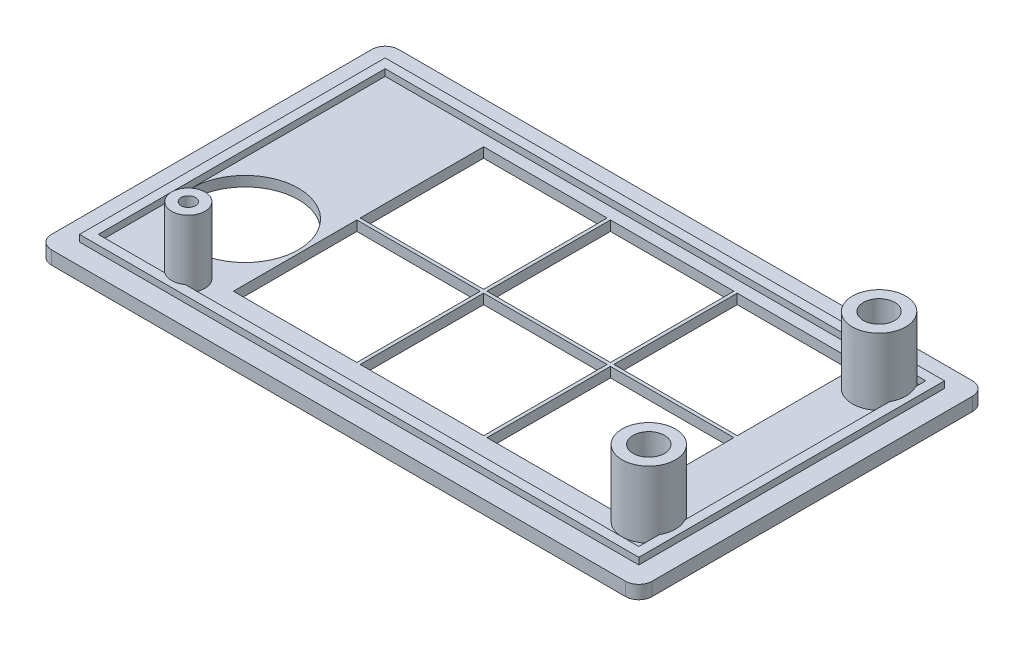
from build123d import *

# Parameters (mm, degrees)
SKETCH3_W               = 90
SKETCH3_H               = 52
BOSS_EXTRUDE2_DEPTH     = 2
FILLET2_R               = 2
BOSS_EXTRUDE3_START     = 2
SKETCH7_R               = 4
BOSS_EXTRUDE3_DEPTH     = 10
CUT_EXTRUDE2_DEPTH      = 54.338541412
CUT_EXTRUDE2_DEPTH_BACK = 4
CUT_EXTRUDE2_START      = 2
SKETCH8_R               = 2.35
BOSS_EXTRUDE4_START     = 2
SKETCH10_W              = 83.8
SKETCH10_H              = 45.8
SKETCH10_W_2            = 81
SKETCH10_H_2            = 43
BOSS_EXTRUDE4_DEPTH     = 1
BOSS_EXTRUDE5_START     = 2
SKETCH11_R              = 2.5
BOSS_EXTRUDE5_DEPTH     = 10
CUT_EXTRUDE3_START      = 12
SKETCH12_R              = 1.075
CUT_EXTRUDE3_DEPTH      = 10
SKETCH4_W               = 83
SKETCH4_H               = 45
CUT_EXTRUDE4_DEPTH      = 0.5
CUT_EXTRUDE5_DEPTH      = 54.338541412
CUT_EXTRUDE5_DEPTH_BACK = 54.338541412
SKETCH5_R               = 8
SKETCH5_W               = 18.5
SKETCH5_H               = 18.5


with BuildPart() as part:
    # Sketch3 → Boss-Extrude2 (new body)
    with BuildSketch(Plane(origin=(0, 0, 0), x_dir=(1, 0, 0), z_dir=(0, 1, 0))):
        Rectangle(SKETCH3_W, SKETCH3_H)
    extrude(amount=BOSS_EXTRUDE2_DEPTH)

    # Fillet2
    fillet2_edges = [part.edges().sort_by_distance(p)[0] for p in [
        (-45, 1, -26),
        (45, 1, -26),
        (45, 1, 26),
        (-45, 1, 26),
    ]]
    fillet(fillet2_edges, radius=FILLET2_R)

    # Sketch7 → Boss-Extrude3 (add)
    with BuildSketch(Plane(origin=(0, 0, 0), x_dir=(1, 0, 0), z_dir=(0, 1, 0)).offset(BOSS_EXTRUDE3_START)):
        with Locations(Location((37, 18, 0), (0, 0, 270))):
            Circle(SKETCH7_R)
        with Locations(Location((37, -16.5, 0), (0, 0, 270))):
            Circle(SKETCH7_R)
    extrude(amount=BOSS_EXTRUDE3_DEPTH)

    # Sketch8 → Cut-Extrude2 (cut, two sides: drawn at the far end of the back side and taken through both)
    with BuildSketch(Plane(origin=(0, 0, 0), x_dir=(1, 0, 0), z_dir=(0, 1, 0)).offset(CUT_EXTRUDE2_START - CUT_EXTRUDE2_DEPTH_BACK)):
        with Locations(Location((37, 18, 0), (0, 0, 270))):
            Circle(SKETCH8_R)
        with Locations(Location((37, -16.5, 0), (0, 0, 270))):
            Circle(SKETCH8_R)
    extrude(amount=CUT_EXTRUDE2_DEPTH + CUT_EXTRUDE2_DEPTH_BACK, mode=Mode.SUBTRACT)

    # Sketch10 → Boss-Extrude4 (add)
    with BuildSketch(Plane(origin=(0, 0, 0), x_dir=(1, 0, 0), z_dir=(0, 1, 0)).offset(BOSS_EXTRUDE4_START)):
        Rectangle(SKETCH10_W, SKETCH10_H)
        Rectangle(SKETCH10_W_2, SKETCH10_H_2, mode=Mode.SUBTRACT)
    extrude(amount=BOSS_EXTRUDE4_DEPTH)

    # Sketch11 → Boss-Extrude5 (add)
    with BuildSketch(Plane(origin=(0, 0, 0), x_dir=(1, 0, 0), z_dir=(0, 1, 0)).offset(BOSS_EXTRUDE5_START)):
        with Locations(Location((-29, -19.5, 0), (0, 0, 233.130102354))):
            Circle(SKETCH11_R)
    extrude(amount=BOSS_EXTRUDE5_DEPTH)

    # Sketch12 → Cut-Extrude3 (cut)
    with BuildSketch(Plane(origin=(0, 0, 0), x_dir=(1, 0, 0), z_dir=(0, 1, 0)).offset(CUT_EXTRUDE3_START)):
        with Locations(Location((-29, -19.5, 0), (0, 0, 270))):
            Circle(SKETCH12_R)
    extrude(amount=-CUT_EXTRUDE3_DEPTH, mode=Mode.SUBTRACT)

    # Sketch4 → Cut-Extrude4 (cut)
    with BuildSketch(Plane(origin=(0, 0, 0), x_dir=(1, 0, 0), z_dir=(0, 1, 0))):
        Rectangle(SKETCH4_W, SKETCH4_H)
    extrude(amount=CUT_EXTRUDE4_DEPTH, mode=Mode.SUBTRACT)

    # Sketch5 → Cut-Extrude5 (cut, two sides: drawn at the far end of the back side and taken through both)
    with BuildSketch(Plane(origin=(0, 0, 0), x_dir=(1, 0, 0), z_dir=(0, 1, 0)).offset(-CUT_EXTRUDE5_DEPTH_BACK)):
        with Locations(Location((-32.5, -7.5, 0), (0, 0, 180))):
            Circle(SKETCH5_R)
        with Locations((-14.75, 10.5)):
            Rectangle(SKETCH5_W, SKETCH5_H)
        with Locations((23.25, 10.5)):
            Rectangle(SKETCH5_W, SKETCH5_H)
        with Locations((-14.75, -8.5)):
            Rectangle(SKETCH5_W, SKETCH5_H)
        with Locations((23.25, -8.5)):
            Rectangle(SKETCH5_W, SKETCH5_H)
        with Locations((4.25, 10.5)):
            Rectangle(SKETCH5_W, SKETCH5_H)
        with Locations((4.25, -8.5)):
            Rectangle(SKETCH5_W, SKETCH5_H)
    extrude(amount=CUT_EXTRUDE5_DEPTH + CUT_EXTRUDE5_DEPTH_BACK, mode=Mode.SUBTRACT)


solid = part.part
